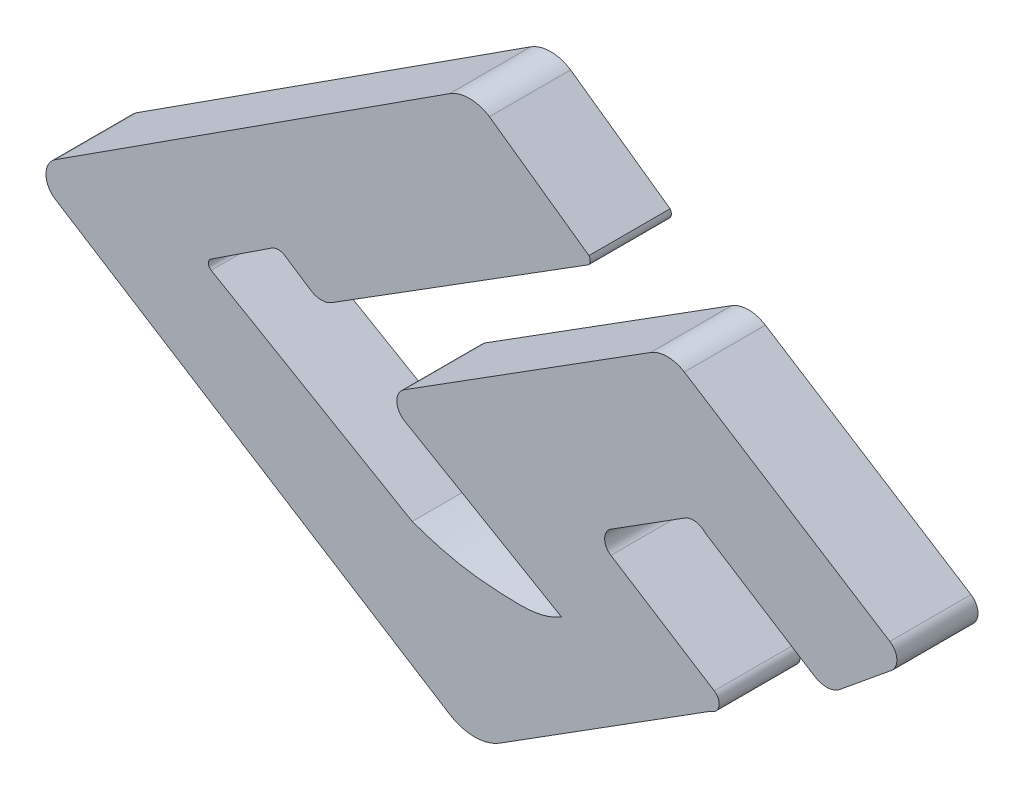
from build123d import *

# Parameters (mm, degrees)
EXTRUDE_1_DEPTH = 13


with BuildPart() as part:
    # 草图1 → 凸台-拉伸1 (new body)
    with BuildSketch(Plane.XY):
        with BuildLine():
            Line((47.511484966, 142.033134461), (110.638937631, 102.207761638))
            ThreePointArc((110.638937631, 102.207761638), (114.665827011, 101.043744068), (118.692649861, 102.207991771))
            Line((118.692649861, 102.207991771), (152.521772353, 123.552557153))
            ThreePointArc((152.521772353, 123.552557153), (153.81505185, 124.925900716), (153.04891629, 126.649757061))
            Line((153.04891629, 126.649757061), (136.489129492, 137.165850219))
            ThreePointArc((136.489129492, 137.165850219), (135.492047357, 138.983315731), (136.494426509, 140.797865181))
            Line((136.494426509, 140.797865181), (148.334619381, 148.268463065))
            ThreePointArc((148.334619381, 148.268463065), (150.056794855, 148.643643111), (151.618362398, 147.826235477))
            Line((151.618362398, 147.826235477), (169.12186053, 136.710849803))
            ThreePointArc((169.12186053, 136.710849803), (171.033857417, 136.155053995), (172.945854303, 136.710849803))
            Line((172.945854303, 136.710849803), (181.18602163, 143.463793951))
            ThreePointArc((181.18602163, 143.463793951), (182.315098555, 145.518303295), (181.18602163, 147.572812638))
            Line((181.18602163, 147.572812638), (148.25303307, 168.486510374))
            ThreePointArc((148.25303307, 168.486510374), (145.550526458, 169.274236069), (142.84573367, 168.494396508))
            Line((142.84573367, 168.494396508), (103.370364428, 143.587318295))
            ThreePointArc((103.370364428, 143.587318295), (102.195954559, 141.45767708), (103.370375956, 139.328042221))
            Line((103.370375956, 139.328042221), (128.55687664, 124.67236247))
            add(Edge.make_bspline(
                [(104.659407223, 125.955435879), (107.630554524, 124.900634476), (112.429978189, 123.518860294), (120.55796174, 122.941026513), (125.679246688, 122.847455284), (128.55687664, 124.67236247)],
                knots=[0, 0, 0, 0, 0.387587107, 0.604017493, 1, 1, 1, 1], degree=3))
            Line((104.659407223, 125.955435879), (72.452510917, 144.69618768))
            ThreePointArc((72.452510917, 144.69618768), (72.002596111, 145.454480563), (72.410625454, 146.236109301))
            Line((72.410625454, 146.236109301), (82.149898801, 152.636203216))
            ThreePointArc((82.149898801, 152.636203216), (83.207924224, 152.95258239), (84.265790914, 152.635672874))
            Line((84.265790914, 152.635672874), (88.402902158, 149.914029293))
            ThreePointArc((88.402902158, 149.914029293), (90.083226665, 149.40103976), (91.774170174, 149.877861281))
            Line((91.774170174, 149.877861281), (132.907259914, 175.690631112))
            ThreePointArc((132.907259914, 175.690631112), (133.18297095, 176.334767089), (132.980807122, 177.005630354))
            Line((132.980807122, 177.005630354), (117.031500859, 188.303055623))
            ThreePointArc((117.031500859, 188.303055623), (113.835262941, 189.244329835), (110.639025024, 188.303055623))
            Line((110.639025024, 188.303055623), (47.48382646, 147.572951165))
            ThreePointArc((47.48382646, 147.572951165), (45.979061901, 144.795460967), (47.511484966, 142.033134461))
        make_face()
    extrude(amount=EXTRUDE_1_DEPTH)


solid = part.part
